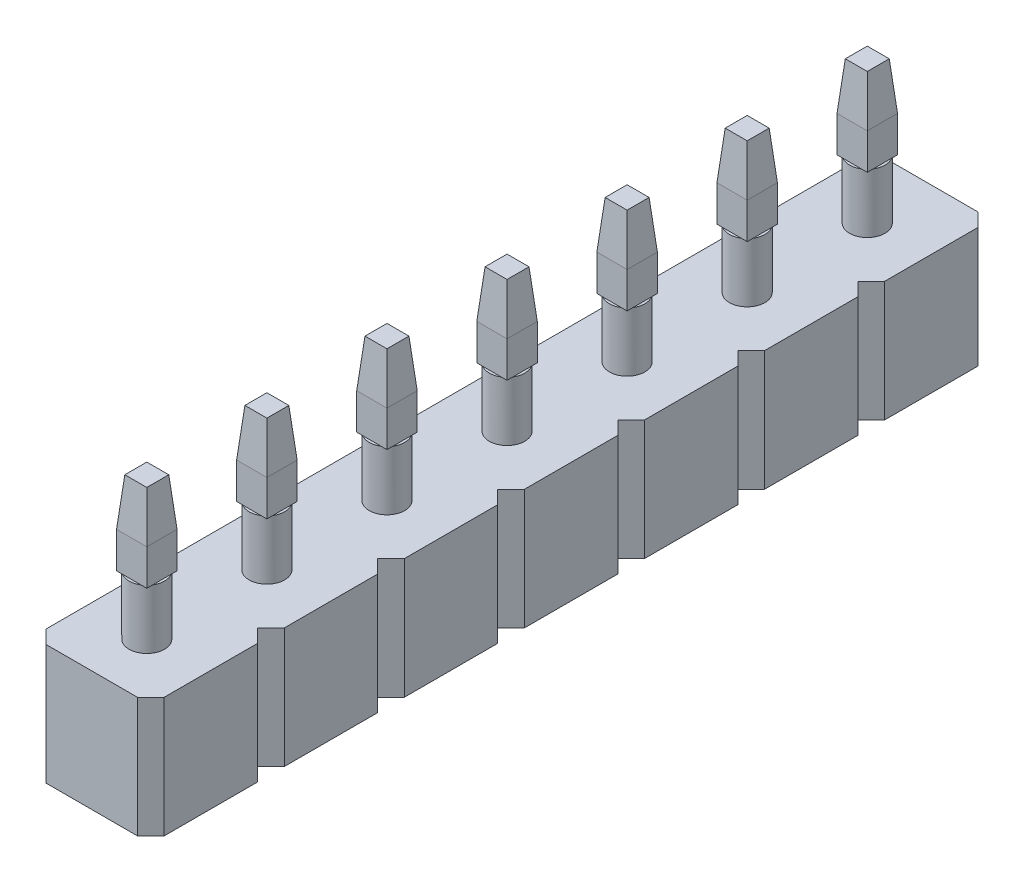
from build123d import *
from OCP.BRepFilletAPI import BRepFilletAPI_MakeChamfer

# Parameters (mm, degrees)
SKETCH1_W           = 2.5
SKETCH1_H           = 2.54
BOSS_EXTRUDE1_DEPTH = 2.54
SKETCH3_R           = 0.375
BOSS_EXTRUDE2_DEPTH = 1.25
SKETCH4_W           = 0.64
SKETCH4_H           = 0.64
BOSS_EXTRUDE3_DEPTH = 1.76
CUT_EXTRUDE1_DEPTH  = 2.54
LPATTERN5_COUNT     = 7
LPATTERN5_PITCH     = 2.54
CHAMFER3_SIZE       = 1
CHAMFER3_SIZE2      = 0.087488664


with BuildPart() as part:
    # Sketch1 → Boss-Extrude1 (new body)
    with BuildSketch(Plane(origin=(0, 0, 0), x_dir=(1, 0, 0), z_dir=(0, 1, 0))):
        with Locations((1.25, 1.27)):
            Rectangle(SKETCH1_W, SKETCH1_H)
    boss_extrude1 = extrude(amount=BOSS_EXTRUDE1_DEPTH)

    # Sketch3 → Boss-Extrude2 (add)
    with BuildSketch(Plane(origin=(0, 2.54, 0), x_dir=(1, 0, 0), z_dir=(0, 1, 0))):
        with Locations(Location((1.25, 1.165, 0), (0, 0, 270))):
            Circle(SKETCH3_R)
    boss_extrude2 = extrude(amount=BOSS_EXTRUDE2_DEPTH)

    # Sketch4 → Boss-Extrude3 (add)
    with BuildSketch(Plane(origin=(0, 3.79, 0), x_dir=(1, 0, 0), z_dir=(0, 1, 0))):
        with Locations((1.25, 1.165)):
            Rectangle(SKETCH4_W, SKETCH4_H)
    boss_extrude3 = extrude(amount=BOSS_EXTRUDE3_DEPTH)

    # Sketch5 → Cut-Extrude1 (cut)
    with BuildSketch(Plane(origin=(0, 2.54, 0), x_dir=(1, 0, 0), z_dir=(0, 1, 0))):
        Polygon((0.282842712, 2.54), (0, 2.257157288), (0, 2.54), align=None)
        Polygon((2.5, 2.54), (2.5, 2.257157288), (2.217157288, 2.54), align=None)
        Polygon((2.5, 0), (2.5, 0.282842712), (2.217157288, 0), align=None)
        Polygon((0, 0), (0, 0.282842712), (0.282842712, 0), align=None)
    cut_extrude1 = extrude(amount=-CUT_EXTRUDE1_DEPTH, mode=Mode.SUBTRACT)

    # LPattern5: Boss-Extrude1, Boss-Extrude2, Boss-Extrude3, Cut-Extrude1 ×7
    with Locations(*[(0, 0, -i * LPATTERN5_PITCH) for i in range(1, LPATTERN5_COUNT)]):
        add(boss_extrude1)
        add(boss_extrude2)
        add(boss_extrude3)
        add(cut_extrude1, mode=Mode.SUBTRACT)

    # Chamfer3: one chamfer whose edges measure the first distance from different faces: ONE call of the kernel's chamfer builder (chamfer() names one face for all edges)
    chamfer3_edges_1 = [part.edges().sort_by_distance(p)[0] for p in [
        (1.57, 5.55, -3.705),
    ]]
    chamfer3_side_1 = [part.faces().sort_by_distance(p)[0] for p in [
        (1.57, 4.67, -3.705),
    ]]
    chamfer3_edges_2 = [part.edges().sort_by_distance(p)[0] for p in [
        (1.25, 5.55, -4.025),
    ]]
    chamfer3_side_2 = [part.faces().sort_by_distance(p)[0] for p in [
        (1.25, 4.67, -4.025),
    ]]
    chamfer3_edges_3 = [part.edges().sort_by_distance(p)[0] for p in [
        (0.93, 5.55, -3.705),
    ]]
    chamfer3_side_3 = [part.faces().sort_by_distance(p)[0] for p in [
        (0.93, 4.67, -3.705),
    ]]
    chamfer3_edges_4 = [part.edges().sort_by_distance(p)[0] for p in [
        (1.25, 5.55, -3.385),
    ]]
    chamfer3_side_4 = [part.faces().sort_by_distance(p)[0] for p in [
        (1.25, 4.67, -3.385),
    ]]
    chamfer3_edges_5 = [part.edges().sort_by_distance(p)[0] for p in [
        (1.57, 5.55, -6.245),
    ]]
    chamfer3_side_5 = [part.faces().sort_by_distance(p)[0] for p in [
        (1.57, 4.67, -6.245),
    ]]
    chamfer3_edges_6 = [part.edges().sort_by_distance(p)[0] for p in [
        (1.25, 5.55, -6.565),
    ]]
    chamfer3_side_6 = [part.faces().sort_by_distance(p)[0] for p in [
        (1.25, 4.67, -6.565),
    ]]
    chamfer3_edges_7 = [part.edges().sort_by_distance(p)[0] for p in [
        (0.93, 5.55, -6.245),
    ]]
    chamfer3_side_7 = [part.faces().sort_by_distance(p)[0] for p in [
        (0.93, 4.67, -6.245),
    ]]
    chamfer3_edges_8 = [part.edges().sort_by_distance(p)[0] for p in [
        (1.25, 5.55, -5.925),
    ]]
    chamfer3_side_8 = [part.faces().sort_by_distance(p)[0] for p in [
        (1.25, 4.67, -5.925),
    ]]
    chamfer3_edges_9 = [part.edges().sort_by_distance(p)[0] for p in [
        (1.57, 5.55, -8.785),
    ]]
    chamfer3_side_9 = [part.faces().sort_by_distance(p)[0] for p in [
        (1.57, 4.67, -8.785),
    ]]
    chamfer3_edges_10 = [part.edges().sort_by_distance(p)[0] for p in [
        (1.25, 5.55, -9.105),
    ]]
    chamfer3_side_10 = [part.faces().sort_by_distance(p)[0] for p in [
        (1.25, 4.67, -9.105),
    ]]
    chamfer3_edges_11 = [part.edges().sort_by_distance(p)[0] for p in [
        (0.93, 5.55, -8.785),
    ]]
    chamfer3_side_11 = [part.faces().sort_by_distance(p)[0] for p in [
        (0.93, 4.67, -8.785),
    ]]
    chamfer3_edges_12 = [part.edges().sort_by_distance(p)[0] for p in [
        (1.25, 5.55, -8.465),
    ]]
    chamfer3_side_12 = [part.faces().sort_by_distance(p)[0] for p in [
        (1.25, 4.67, -8.465),
    ]]
    chamfer3_edges_13 = [part.edges().sort_by_distance(p)[0] for p in [
        (1.57, 5.55, -11.325),
    ]]
    chamfer3_side_13 = [part.faces().sort_by_distance(p)[0] for p in [
        (1.57, 4.67, -11.325),
    ]]
    chamfer3_edges_14 = [part.edges().sort_by_distance(p)[0] for p in [
        (1.25, 5.55, -11.645),
    ]]
    chamfer3_side_14 = [part.faces().sort_by_distance(p)[0] for p in [
        (1.25, 4.67, -11.645),
    ]]
    chamfer3_edges_15 = [part.edges().sort_by_distance(p)[0] for p in [
        (0.93, 5.55, -11.325),
    ]]
    chamfer3_side_15 = [part.faces().sort_by_distance(p)[0] for p in [
        (0.93, 4.67, -11.325),
    ]]
    chamfer3_edges_16 = [part.edges().sort_by_distance(p)[0] for p in [
        (1.25, 5.55, -11.005),
    ]]
    chamfer3_side_16 = [part.faces().sort_by_distance(p)[0] for p in [
        (1.25, 4.67, -11.005),
    ]]
    chamfer3_edges_17 = [part.edges().sort_by_distance(p)[0] for p in [
        (1.57, 5.55, -13.865),
    ]]
    chamfer3_side_17 = [part.faces().sort_by_distance(p)[0] for p in [
        (1.57, 4.67, -13.865),
    ]]
    chamfer3_edges_18 = [part.edges().sort_by_distance(p)[0] for p in [
        (1.25, 5.55, -14.185),
    ]]
    chamfer3_side_18 = [part.faces().sort_by_distance(p)[0] for p in [
        (1.25, 4.67, -14.185),
    ]]
    chamfer3_edges_19 = [part.edges().sort_by_distance(p)[0] for p in [
        (0.93, 5.55, -13.865),
    ]]
    chamfer3_side_19 = [part.faces().sort_by_distance(p)[0] for p in [
        (0.93, 4.67, -13.865),
    ]]
    chamfer3_edges_20 = [part.edges().sort_by_distance(p)[0] for p in [
        (1.25, 5.55, -13.545),
    ]]
    chamfer3_side_20 = [part.faces().sort_by_distance(p)[0] for p in [
        (1.25, 4.67, -13.545),
    ]]
    chamfer3_edges_21 = [part.edges().sort_by_distance(p)[0] for p in [
        (1.57, 5.55, -16.405),
    ]]
    chamfer3_side_21 = [part.faces().sort_by_distance(p)[0] for p in [
        (1.57, 4.67, -16.405),
    ]]
    chamfer3_edges_22 = [part.edges().sort_by_distance(p)[0] for p in [
        (1.25, 5.55, -16.725),
    ]]
    chamfer3_side_22 = [part.faces().sort_by_distance(p)[0] for p in [
        (1.25, 4.67, -16.725),
    ]]
    chamfer3_edges_23 = [part.edges().sort_by_distance(p)[0] for p in [
        (0.93, 5.55, -16.405),
    ]]
    chamfer3_side_23 = [part.faces().sort_by_distance(p)[0] for p in [
        (0.93, 4.67, -16.405),
    ]]
    chamfer3_edges_24 = [part.edges().sort_by_distance(p)[0] for p in [
        (1.25, 5.55, -16.085),
    ]]
    chamfer3_side_24 = [part.faces().sort_by_distance(p)[0] for p in [
        (1.25, 4.67, -16.085),
    ]]
    chamfer3_edges_25 = [part.edges().sort_by_distance(p)[0] for p in [
        (1.57, 5.55, -1.165),
    ]]
    chamfer3_side_25 = [part.faces().sort_by_distance(p)[0] for p in [
        (1.57, 4.67, -1.165),
    ]]
    chamfer3_edges_26 = [part.edges().sort_by_distance(p)[0] for p in [
        (1.25, 5.55, -1.485),
    ]]
    chamfer3_side_26 = [part.faces().sort_by_distance(p)[0] for p in [
        (1.25, 4.67, -1.485),
    ]]
    chamfer3_edges_27 = [part.edges().sort_by_distance(p)[0] for p in [
        (0.93, 5.55, -1.165),
    ]]
    chamfer3_side_27 = [part.faces().sort_by_distance(p)[0] for p in [
        (0.93, 4.67, -1.165),
    ]]
    chamfer3_edges_28 = [part.edges().sort_by_distance(p)[0] for p in [
        (1.25, 5.55, -0.845),
    ]]
    chamfer3_side_28 = [part.faces().sort_by_distance(p)[0] for p in [
        (1.25, 4.67, -0.845),
    ]]
    chamfer3 = BRepFilletAPI_MakeChamfer(part.part.solid().wrapped)
    for e in chamfer3_edges_1:
        chamfer3.Add(CHAMFER3_SIZE, CHAMFER3_SIZE2, e.wrapped, chamfer3_side_1[0].wrapped)  # the first distance lies on this face
    for e in chamfer3_edges_2:
        chamfer3.Add(CHAMFER3_SIZE, CHAMFER3_SIZE2, e.wrapped, chamfer3_side_2[0].wrapped)  # the first distance lies on this face
    for e in chamfer3_edges_3:
        chamfer3.Add(CHAMFER3_SIZE, CHAMFER3_SIZE2, e.wrapped, chamfer3_side_3[0].wrapped)  # the first distance lies on this face
    for e in chamfer3_edges_4:
        chamfer3.Add(CHAMFER3_SIZE, CHAMFER3_SIZE2, e.wrapped, chamfer3_side_4[0].wrapped)  # the first distance lies on this face
    for e in chamfer3_edges_5:
        chamfer3.Add(CHAMFER3_SIZE, CHAMFER3_SIZE2, e.wrapped, chamfer3_side_5[0].wrapped)  # the first distance lies on this face
    for e in chamfer3_edges_6:
        chamfer3.Add(CHAMFER3_SIZE, CHAMFER3_SIZE2, e.wrapped, chamfer3_side_6[0].wrapped)  # the first distance lies on this face
    for e in chamfer3_edges_7:
        chamfer3.Add(CHAMFER3_SIZE, CHAMFER3_SIZE2, e.wrapped, chamfer3_side_7[0].wrapped)  # the first distance lies on this face
    for e in chamfer3_edges_8:
        chamfer3.Add(CHAMFER3_SIZE, CHAMFER3_SIZE2, e.wrapped, chamfer3_side_8[0].wrapped)  # the first distance lies on this face
    for e in chamfer3_edges_9:
        chamfer3.Add(CHAMFER3_SIZE, CHAMFER3_SIZE2, e.wrapped, chamfer3_side_9[0].wrapped)  # the first distance lies on this face
    for e in chamfer3_edges_10:
        chamfer3.Add(CHAMFER3_SIZE, CHAMFER3_SIZE2, e.wrapped, chamfer3_side_10[0].wrapped)  # the first distance lies on this face
    for e in chamfer3_edges_11:
        chamfer3.Add(CHAMFER3_SIZE, CHAMFER3_SIZE2, e.wrapped, chamfer3_side_11[0].wrapped)  # the first distance lies on this face
    for e in chamfer3_edges_12:
        chamfer3.Add(CHAMFER3_SIZE, CHAMFER3_SIZE2, e.wrapped, chamfer3_side_12[0].wrapped)  # the first distance lies on this face
    for e in chamfer3_edges_13:
        chamfer3.Add(CHAMFER3_SIZE, CHAMFER3_SIZE2, e.wrapped, chamfer3_side_13[0].wrapped)  # the first distance lies on this face
    for e in chamfer3_edges_14:
        chamfer3.Add(CHAMFER3_SIZE, CHAMFER3_SIZE2, e.wrapped, chamfer3_side_14[0].wrapped)  # the first distance lies on this face
    for e in chamfer3_edges_15:
        chamfer3.Add(CHAMFER3_SIZE, CHAMFER3_SIZE2, e.wrapped, chamfer3_side_15[0].wrapped)  # the first distance lies on this face
    for e in chamfer3_edges_16:
        chamfer3.Add(CHAMFER3_SIZE, CHAMFER3_SIZE2, e.wrapped, chamfer3_side_16[0].wrapped)  # the first distance lies on this face
    for e in chamfer3_edges_17:
        chamfer3.Add(CHAMFER3_SIZE, CHAMFER3_SIZE2, e.wrapped, chamfer3_side_17[0].wrapped)  # the first distance lies on this face
    for e in chamfer3_edges_18:
        chamfer3.Add(CHAMFER3_SIZE, CHAMFER3_SIZE2, e.wrapped, chamfer3_side_18[0].wrapped)  # the first distance lies on this face
    for e in chamfer3_edges_19:
        chamfer3.Add(CHAMFER3_SIZE, CHAMFER3_SIZE2, e.wrapped, chamfer3_side_19[0].wrapped)  # the first distance lies on this face
    for e in chamfer3_edges_20:
        chamfer3.Add(CHAMFER3_SIZE, CHAMFER3_SIZE2, e.wrapped, chamfer3_side_20[0].wrapped)  # the first distance lies on this face
    for e in chamfer3_edges_21:
        chamfer3.Add(CHAMFER3_SIZE, CHAMFER3_SIZE2, e.wrapped, chamfer3_side_21[0].wrapped)  # the first distance lies on this face
    for e in chamfer3_edges_22:
        chamfer3.Add(CHAMFER3_SIZE, CHAMFER3_SIZE2, e.wrapped, chamfer3_side_22[0].wrapped)  # the first distance lies on this face
    for e in chamfer3_edges_23:
        chamfer3.Add(CHAMFER3_SIZE, CHAMFER3_SIZE2, e.wrapped, chamfer3_side_23[0].wrapped)  # the first distance lies on this face
    for e in chamfer3_edges_24:
        chamfer3.Add(CHAMFER3_SIZE, CHAMFER3_SIZE2, e.wrapped, chamfer3_side_24[0].wrapped)  # the first distance lies on this face
    for e in chamfer3_edges_25:
        chamfer3.Add(CHAMFER3_SIZE, CHAMFER3_SIZE2, e.wrapped, chamfer3_side_25[0].wrapped)  # the first distance lies on this face
    for e in chamfer3_edges_26:
        chamfer3.Add(CHAMFER3_SIZE, CHAMFER3_SIZE2, e.wrapped, chamfer3_side_26[0].wrapped)  # the first distance lies on this face
    for e in chamfer3_edges_27:
        chamfer3.Add(CHAMFER3_SIZE, CHAMFER3_SIZE2, e.wrapped, chamfer3_side_27[0].wrapped)  # the first distance lies on this face
    for e in chamfer3_edges_28:
        chamfer3.Add(CHAMFER3_SIZE, CHAMFER3_SIZE2, e.wrapped, chamfer3_side_28[0].wrapped)  # the first distance lies on this face
    add(Compound.cast(chamfer3.Shape()), mode=Mode.REPLACE)


solid = part.part
